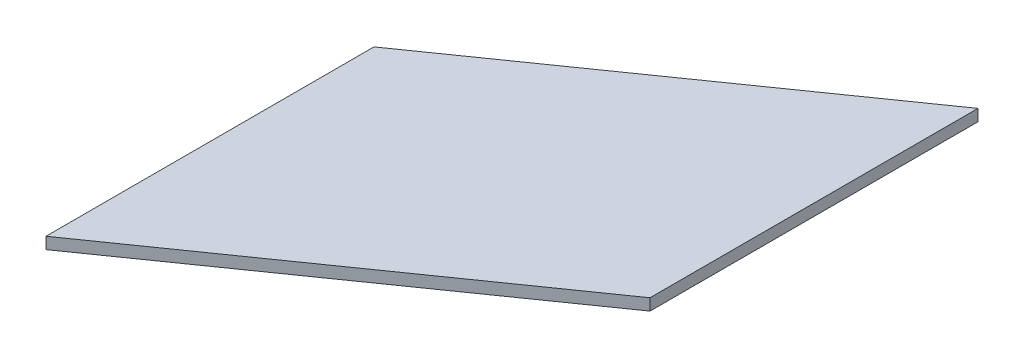
from build123d import *

# Parameters (mm, degrees)
BOSS_EXTRUDE1_DEPTH = 12.7


with BuildPart() as part:
    # Sketch1 → Boss-Extrude1 (new body)
    with BuildSketch(Plane(origin=(0, 0, 0), x_dir=(1, 0, 0), z_dir=(0, 1, 0))):
        Polygon((0, 0), (0, 359.06343047), (388.9375, 631.400399863), (388.9375, 272.336969392), align=None)
    extrude(amount=BOSS_EXTRUDE1_DEPTH)


solid = part.part
